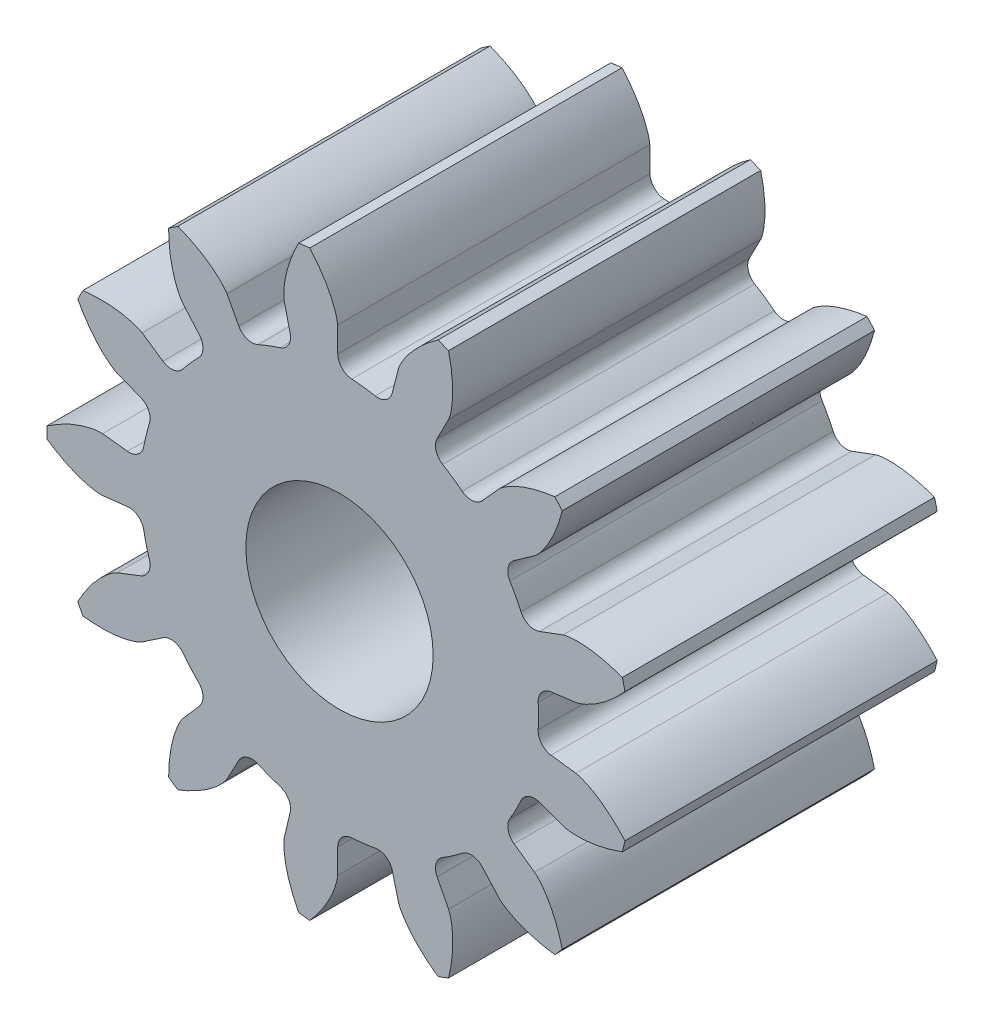
from build123d import *

# Parameters (mm, degrees)
BLANK_SKETCH_R     = 9.375
BLANK_DEPTH        = 10
TOOTH_SPACE_DEPTH  = 17.606662819
TEETH_COUNT        = 13
SKETCH1_R          = 3
CUT_EXTRUDE1_DEPTH = 10


with BuildPart() as part:
    # Blank Sketch → Blank (new body)
    with BuildSketch(Plane.XY):
        Circle(BLANK_SKETCH_R)
    extrude(amount=BLANK_DEPTH)

    # Tooth Space Sketch → Tooth Space (cut, symmetric)
    with BuildSketch(Plane.XY):
        with BuildLine():
            Line((7.57156058, 0.982208848), (6.776729091, 0.879100577))
            ThreePointArc((6.776729091, 0.879100577), (6.471825007, 0.710803469), (6.363679221, 0.379752256))
            ThreePointArc((6.363679221, 0.379752256), (6.375, 0), (6.363679221, -0.379752256))
            ThreePointArc((6.363679221, -0.379752256), (6.471825007, -0.710803469), (6.776729091, -0.879100577))
            Line((6.776729091, -0.879100577), (7.57156058, -0.982208848))
            add(Edge.make_bspline(
                [(7.57156058, -0.982208848), (7.576789428, -0.982996328), (7.591401414, -0.985535943), (7.618799471, -0.991641519), (7.663093504, -1.003438958), (7.718858004, -1.021148573), (7.790034771, -1.047078018), (7.87261038, -1.081490922), (7.961878204, -1.123307091), (8.057252358, -1.173048166), (8.150745387, -1.226375929), (8.242364416, -1.282963375), (8.332080974, -1.342357551), (8.438818355, -1.417807302), (8.564041487, -1.513113734), (8.706106193, -1.631355571), (8.861939225, -1.773392296), (9.014737057, -1.926310774), (9.16001877, -2.08339363), (9.300646401, -2.249361491), (9.432315869, -2.415070667), (9.562381831, -2.594184631), (9.679055435, -2.76311685), (9.8020208, -2.959681942), (9.899017528, -3.120487263), (9.992541089, -3.292378012), (10.037064878, -3.376874967), (10.059396552, -3.420404365)],
                knots=[0, 0, 0, 0, 0, 0.005376748, 0.015083688, 0.02853182, 0.046610139, 0.064854849, 0.092110525, 0.119476175, 0.146842495, 0.174208853, 0.201574955, 0.228941013, 0.256307345, 0.307035032, 0.361767351, 0.41649966, 0.471231936, 0.525964281, 0.580696615, 0.635428982, 0.690161387, 0.744893688, 0.799626083, 0.854358408, 0.909090916, 0.909090916, 0.909090916, 0.909090916, 0.909090916], degree=4))
            Line((10.059396552, -3.420404365), (10.059396552, 3.420404365))
            add(Edge.make_bspline(
                [(7.57156058, 0.982208848), (7.576789428, 0.982996328), (7.591401414, 0.985535943), (7.618799471, 0.991641519), (7.663093504, 1.003438958), (7.718858004, 1.021148573), (7.790034771, 1.047078018), (7.87261038, 1.081490922), (7.961878204, 1.123307091), (8.057252358, 1.173048166), (8.150745387, 1.226375929), (8.242364416, 1.282963375), (8.332080974, 1.342357551), (8.438818355, 1.417807302), (8.564041487, 1.513113734), (8.706106193, 1.631355571), (8.861939225, 1.773392296), (9.014737057, 1.926310774), (9.16001877, 2.08339363), (9.300646401, 2.249361491), (9.432315869, 2.415070667), (9.562381831, 2.594184631), (9.679055435, 2.76311685), (9.8020208, 2.959681942), (9.899017528, 3.120487263), (9.992541089, 3.292378012), (10.037064878, 3.376874967), (10.059396552, 3.420404365)],
                knots=[0, 0, 0, 0, 0, 0.005376748, 0.015083688, 0.02853182, 0.046610139, 0.064854849, 0.092110525, 0.119476175, 0.146842495, 0.174208853, 0.201574955, 0.228941013, 0.256307345, 0.307035032, 0.361767351, 0.41649966, 0.471231936, 0.525964281, 0.580696615, 0.635428982, 0.690161387, 0.744893688, 0.799626083, 0.854358408, 0.909090916, 0.909090916, 0.909090916, 0.909090916, 0.909090916], degree=4))
        make_face()
    tooth_space = extrude(amount=TOOTH_SPACE_DEPTH, both=True, mode=Mode.SUBTRACT)

    # Teeth: Tooth Space ×13 about axis
    teeth_axis = Axis((0, 0, -0.50007105), (0, 0, 1))
    for i in range(1, TEETH_COUNT):
        add(tooth_space.rotate(teeth_axis, i * 360 / TEETH_COUNT), mode=Mode.SUBTRACT)

    # Sketch1 → Cut-Extrude1 (cut)
    with BuildSketch(Plane(origin=(0, 0, 0), x_dir=(-1, 0, 0), z_dir=(0, 0, -1))):
        Circle(SKETCH1_R)
    extrude(amount=-CUT_EXTRUDE1_DEPTH, mode=Mode.SUBTRACT)


solid = part.part
